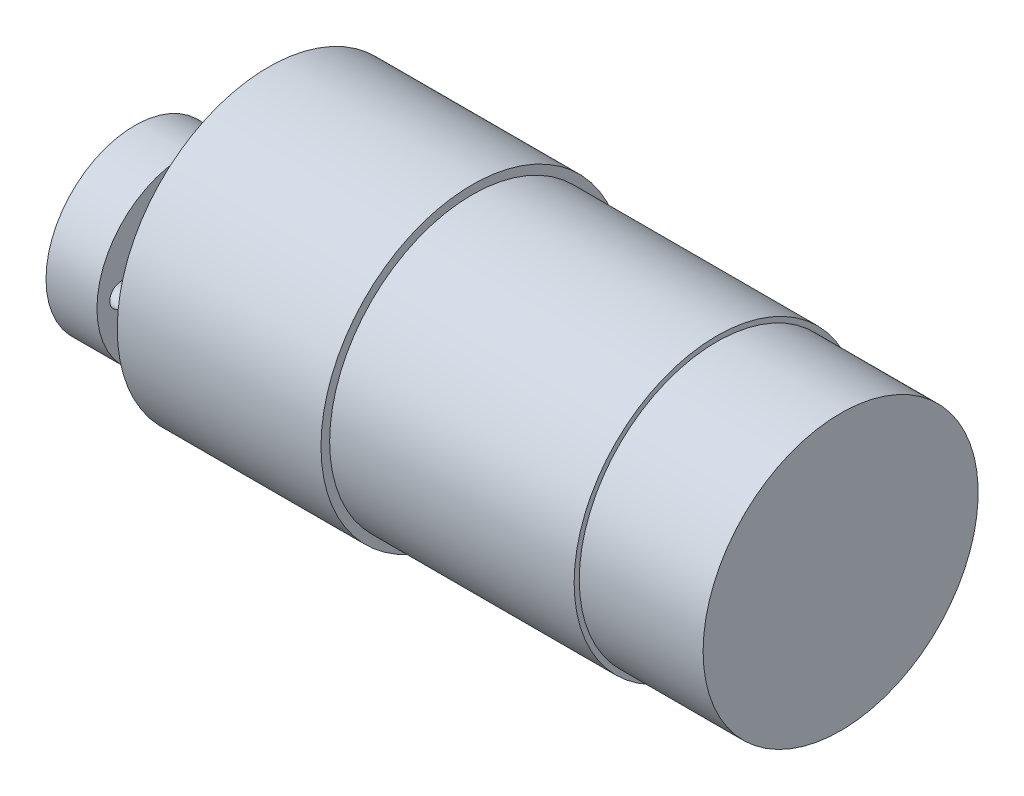
from build123d import *

# Parameters (mm, degrees)
ESQUISSE6_R                                   = 18.8595
BOSS_EXTRU_2_DEPTH                            = 25.4
ESQUISSE7_R                                   = 17.78
BOSS_EXTRU_3_DEPTH                            = 30.48
ESQUISSE8_R                                   = 17.145
BOSS_EXTRU_4_DEPTH                            = 15.4432
ESQUISSE9_R                                   = 5.969
BOSS_EXTRU_5_DEPTH                            = 6.096
ESQUISSE10_R                                  = 4.699
BOSS_EXTRU_6_DEPTH                            = 4.233333333
ESQUISSE11_R                                  = 11.0617
BOSS_EXTRU_7_DEPTH                            = 6.35
ESQUISSE12_R                                  = 4.7752
BOSS_EXTRU_8_DEPTH                            = 3.302
PER_AGE_POUR_TUYAU_POUR_TROU_TARAUD_1_1_D     = 6.1468
PER_AGE_POUR_TUYAU_POUR_TROU_TARAUD_1_1_DEPTH = 19.981333333
BOSS_EXTRU_9_DEPTH                            = 19.981333333
BOSS_EXTRU_10_DEPTH                           = 2.032
ENL_V_MAT_EXTRU_2_REACH                       = 93.955
ESQUISSE18_R                                  = 1.4605
ESQUISSE19_R                                  = 1.500000048
ENL_V_MAT_EXTRU_3_DEPTH                       = 5


with BuildPart() as part:
    # Esquisse6 → Boss.-Extru.2 (new body)
    with BuildSketch(Plane(origin=(0, 0, 0), x_dir=(0, 0, -1), z_dir=(1, 0, 0))):
        Circle(ESQUISSE6_R)
    extrude(amount=BOSS_EXTRU_2_DEPTH)

    # Esquisse7 → Boss.-Extru.3 (add)
    with BuildSketch(Plane(origin=(25.4, 0, 0), x_dir=(0, 0, -1), z_dir=(1, 0, 0))):
        with Locations(Location((0, 0, 0), (0, 0, 180))):
            Circle(ESQUISSE7_R)
    extrude(amount=BOSS_EXTRU_3_DEPTH)

    # Esquisse8 → Boss.-Extru.4 (add)
    with BuildSketch(Plane(origin=(55.88, 0, 0), x_dir=(0, 0, -1), z_dir=(1, 0, 0))):
        with Locations(Location((0, 0, 0), (0, 0, 180))):
            Circle(ESQUISSE8_R)
    extrude(amount=BOSS_EXTRU_4_DEPTH)

    # Esquisse9 → Boss.-Extru.5 (add)
    with BuildSketch(Plane.ZY):
        with Locations(Location((0, -6.858, 0), (0, 0, 180))):
            Circle(ESQUISSE9_R)
    extrude(amount=BOSS_EXTRU_5_DEPTH)

    # Esquisse10 → Boss.-Extru.6 (add)
    with BuildSketch(Plane.ZY.offset(6.096)):
        with Locations((0, -6.858)):
            Circle(ESQUISSE10_R)
    extrude(amount=BOSS_EXTRU_6_DEPTH)

    # Esquisse11 → Boss.-Extru.7 (add)
    with BuildSketch(Plane.ZY.offset(10.329333333)):
        with Locations((0, -6.858)):
            Circle(ESQUISSE11_R)
    extrude(amount=BOSS_EXTRU_7_DEPTH)

    # Esquisse12 → Boss.-Extru.8 (add)
    with BuildSketch(Plane.ZY.offset(16.679333333)):
        with Locations(Location((0, -6.858, 0), (0, 0, 180))):
            Circle(ESQUISSE12_R)
    extrude(amount=BOSS_EXTRU_8_DEPTH)

    # Perçage pour tuyau pour trou taraudé 1/161
    with Locations(Plane.ZY.offset(19.981333333)):
        with Locations((0, -6.858)):
            Hole(PER_AGE_POUR_TUYAU_POUR_TROU_TARAUD_1_1_D / 2, depth=PER_AGE_POUR_TUYAU_POUR_TROU_TARAUD_1_1_DEPTH)

    # Esquisse16 → Boss.-Extru.9 (add)
    with BuildSketch(Plane.ZY):
        with BuildLine():
            Line((-1.778, -4.476758467), (1.778, -4.476758467))
            ThreePointArc((1.778, -4.476758467), (0, -9.8298), (-1.778, -4.476758467))
        make_face()
    extrude(amount=BOSS_EXTRU_9_DEPTH)

    # Esquisse17 → Boss.-Extru.10 (add)
    with BuildSketch(Plane.ZY.offset(19.981333333)):
        with BuildLine():
            Line((-1.778, -4.476758467), (1.778, -4.476758467))
            ThreePointArc((1.778, -4.476758467), (0, -9.8298), (-1.778, -4.476758467))
        make_face()
    extrude(amount=BOSS_EXTRU_10_DEPTH)

    # Esquisse18 → Enlèv. mat.-Extru.2 (cut, up to next)
    with BuildSketch(Plane.ZY.offset(16.679333333), mode=Mode.PRIVATE) as enl_v_mat_extru_2_sk1:
        with Locations((0, 1.143)):
            Circle(ESQUISSE18_R)
    enl_v_mat_extru_2_tool1 = extrude(enl_v_mat_extru_2_sk1.sketch, amount=-ENL_V_MAT_EXTRU_2_REACH, mode=Mode.PRIVATE) & part.part
    # Esquisse18 → Enlèv. mat.-Extru.2 (cut, up to next)
    with BuildSketch(Plane.ZY.offset(16.679333333), mode=Mode.PRIVATE) as enl_v_mat_extru_2_sk2:
        with Locations((8.001, -6.858)):
            Circle(ESQUISSE18_R)
    enl_v_mat_extru_2_tool2 = extrude(enl_v_mat_extru_2_sk2.sketch, amount=-ENL_V_MAT_EXTRU_2_REACH, mode=Mode.PRIVATE) & part.part
    # Esquisse18 → Enlèv. mat.-Extru.2 (cut, up to next)
    with BuildSketch(Plane.ZY.offset(16.679333333), mode=Mode.PRIVATE) as enl_v_mat_extru_2_sk3:
        with Locations((0, -14.859)):
            Circle(ESQUISSE18_R)
    enl_v_mat_extru_2_tool3 = extrude(enl_v_mat_extru_2_sk3.sketch, amount=-ENL_V_MAT_EXTRU_2_REACH, mode=Mode.PRIVATE) & part.part
    # Esquisse18 → Enlèv. mat.-Extru.2 (cut, up to next)
    with BuildSketch(Plane.ZY.offset(16.679333333), mode=Mode.PRIVATE) as enl_v_mat_extru_2_sk4:
        with Locations((-8.001, -6.858)):
            Circle(ESQUISSE18_R)
    enl_v_mat_extru_2_tool4 = extrude(enl_v_mat_extru_2_sk4.sketch, amount=-ENL_V_MAT_EXTRU_2_REACH, mode=Mode.PRIVATE) & part.part
    add(enl_v_mat_extru_2_tool1.solids().sort_by_distance((-16.679333, 1.143, 0))[0], mode=Mode.SUBTRACT)
    add(enl_v_mat_extru_2_tool2.solids().sort_by_distance((-16.679333, -6.858, 8.001))[0], mode=Mode.SUBTRACT)
    add(enl_v_mat_extru_2_tool3.solids().sort_by_distance((-16.679333, -14.859, 0))[0], mode=Mode.SUBTRACT)
    add(enl_v_mat_extru_2_tool4.solids().sort_by_distance((-16.679333, -6.858, -8.001))[0], mode=Mode.SUBTRACT)

    # Esquisse19 → Enlèv. mat.-Extru.3 (cut)
    with BuildSketch(Plane.ZY):
        with Locations((9.000000034, 13.228756537)):
            Circle(ESQUISSE19_R)
        with Locations((6.956439205, -14.408606932)):
            Circle(ESQUISSE19_R)
        with Locations((-15.956439239, 1.179850395)):
            Circle(ESQUISSE19_R)
    extrude(amount=-ENL_V_MAT_EXTRU_3_DEPTH, mode=Mode.SUBTRACT)


solid = part.part
